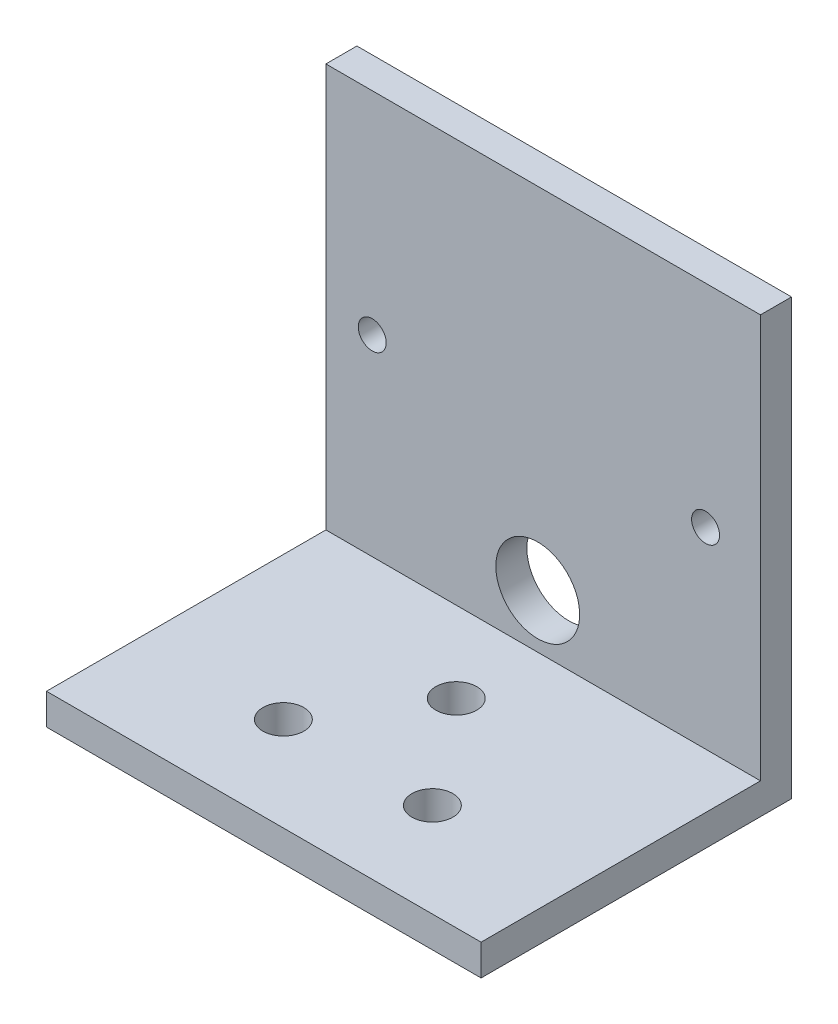
from build123d import *

# Parameters (mm, degrees)
ESQUISSE1_W             = 70
ESQUISSE1_H             = 70
BOSS_EXTRU_1_DEPTH      = 50
ESQUISSE2_W             = 123.137615707
ESQUISSE2_H             = 86.86411441
ENL_V_MAT_EXTRU_1_DEPTH = 217
D_GAGEMENT_M41_D        = 4.5
D_GAGEMENT_M121_D       = 13.5
M6_CLEARANCE_HOLE1_D    = 6.6


with BuildPart() as part:
    # Esquisse1 → Boss.-Extru.1 (new body)
    with BuildSketch(Plane.XY):
        Rectangle(ESQUISSE1_W, ESQUISSE1_H)
    extrude(amount=BOSS_EXTRU_1_DEPTH)

    # Esquisse2 → Enlèv. mat.-Extru.1 (cut)
    with BuildSketch(Plane(origin=(35, 0, 0), x_dir=(0, 0, -1), z_dir=(1, 0, 0))):
        with Locations((-66.568807854, 13.432057205)):
            Rectangle(ESQUISSE2_W, ESQUISSE2_H)
    extrude(amount=-ENL_V_MAT_EXTRU_1_DEPTH, mode=Mode.SUBTRACT)

    # Dégagement M41 (through all)
    with Locations(Plane(origin=(0, 0, 0), x_dir=(-1, 0, 0), z_dir=(0, 0, -1))):
        with Locations((-26.157577905, 0.946358973), (27.533117647, 0.946358973)):
            Hole(D_GAGEMENT_M41_D / 2)

    # Dégagement M121 (through all)
    with Locations(Plane(origin=(0, 0, 0), x_dir=(-1, 0, 0), z_dir=(0, 0, -1))):
        with Locations((0.875458958, -21.366395267)):
            Hole(D_GAGEMENT_M121_D / 2)

    # M6 Clearance Hole1 (through all)
    with Locations(Plane(origin=(0, -30, 0), x_dir=(1, 0, 0), z_dir=(0, 1, 0))):
        with Locations((-12, -34.845648012), (12, -34.845648012), (-1, -18)):
            Hole(M6_CLEARANCE_HOLE1_D / 2)


solid = part.part
